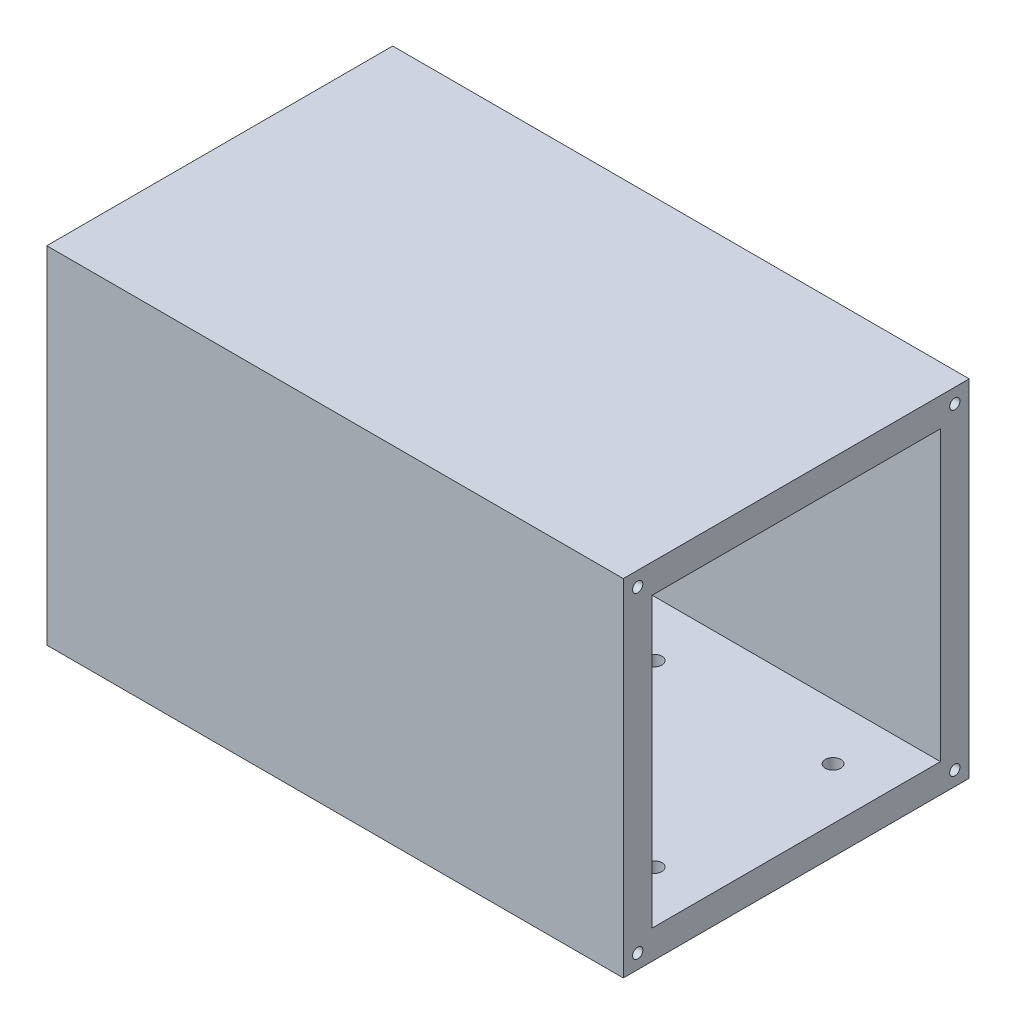
from build123d import *

# Parameters (mm, degrees)
BOSS_EXTRUDE1_DEPTH            = 63.5
BOSS_EXTRUDE1_DEPTH_BACK       = 63.5
SKETCH1_W                      = 76.2
SKETCH1_H                      = 76.2
SKETCH1_W_2                    = 63.5
SKETCH1_H_2                    = 63.5
F_4_40_TAPPED_HOLE1_AT_2_COUNT = 2
F_4_40_TAPPED_HOLE1_AT_2_PITCH = 69.85
F_4_40_TAPPED_HOLE1_AT_3_COUNT = 2
F_4_40_TAPPED_HOLE1_AT_3_PITCH = 98.782817332
F_4_40_TAPPED_HOLE1_AT_4_COUNT = 2
F_4_40_TAPPED_HOLE1_AT_4_PITCH = 69.85
CBORE_FOR_M3_SHCS1_D           = 3.4
CBORE_FOR_M3_SHCS1_DEPTH       = 6.35
CBORE_FOR_M3_SHCS1_CBORE_D     = 6.5
CBORE_FOR_M3_SHCS1_CBORE_DEPTH = 3


with BuildPart() as part:
    # Sketch1 → Boss-Extrude1 (new, two sides: drawn at the far end of the back side and taken through both)
    with BuildSketch(Plane(origin=(0, 0, 0), x_dir=(0, 0, -1), z_dir=(1, 0, 0)).offset(-BOSS_EXTRUDE1_DEPTH_BACK)):
        Rectangle(SKETCH1_W, SKETCH1_H)
        Rectangle(SKETCH1_W_2, SKETCH1_H_2, mode=Mode.SUBTRACT)
    extrude(amount=BOSS_EXTRUDE1_DEPTH + BOSS_EXTRUDE1_DEPTH_BACK)

    # Sketch3 → #4-40 Tapped Hole1 (revolve, cut)
    with BuildSketch(Plane(origin=(63.5, 34.925, 34.925), x_dir=(0, 0, -1), z_dir=(0, 1, 0))):
        Polygon((0, 0), (0, 8.299152758), (1.1303, 7.62), (1.1303, 0), align=None)
    f_4_40_tapped_hole1 = revolve(axis=Axis((69.85, 34.925, 34.925), (-1, 0, 0)), mode=Mode.SUBTRACT)

    # #4-40 Tapped Hole1 at 2: #4-40 Tapped Hole1 ×2
    with Locations(*[(0, 0, -i * F_4_40_TAPPED_HOLE1_AT_2_PITCH) for i in range(1, F_4_40_TAPPED_HOLE1_AT_2_COUNT)]):
        add(f_4_40_tapped_hole1, mode=Mode.SUBTRACT)

    # #4-40 Tapped Hole1 at 3: #4-40 Tapped Hole1 ×2
    with Locations(*[Vector(0, -0.7071067811865475, -0.7071067811865476) * (i * F_4_40_TAPPED_HOLE1_AT_3_PITCH) for i in range(1, F_4_40_TAPPED_HOLE1_AT_3_COUNT)]):
        add(f_4_40_tapped_hole1, mode=Mode.SUBTRACT)

    # #4-40 Tapped Hole1 at 4: #4-40 Tapped Hole1 ×2
    with Locations(*[(0, -i * F_4_40_TAPPED_HOLE1_AT_4_PITCH, 0) for i in range(1, F_4_40_TAPPED_HOLE1_AT_4_COUNT)]):
        add(f_4_40_tapped_hole1, mode=Mode.SUBTRACT)

    # Mirror1: #4-40 Tapped Hole1 across plane
    add(f_4_40_tapped_hole1.mirror(Plane(origin=(0, 0, 0), x_dir=(0, 0, 1), z_dir=(1, 0, 0))), mode=Mode.SUBTRACT)

    # Mirror1 copy 1 sketch → Mirror1 copy 1 (revolve, cut)
    with BuildSketch(Plane(origin=(-63.5, 34.925, -34.925), x_dir=(0, 0, -1), z_dir=(0, 1, 0))):
        Polygon((0, 0), (0, -8.299152758), (1.1303, -7.62), (1.1303, 0), align=None)
    revolve(axis=Axis((-69.85, 34.925, -34.925), (-1, 0, 0)), mode=Mode.SUBTRACT)

    # Mirror1 copy 2 sketch → Mirror1 copy 2 (revolve, cut)
    with BuildSketch(Plane(origin=(-63.5, -34.925, -34.925), x_dir=(0, 0, -1), z_dir=(0, 1, 0))):
        Polygon((0, 0), (0, -8.299152758), (1.1303, -7.62), (1.1303, 0), align=None)
    revolve(axis=Axis((-69.85, -34.925, -34.925), (-1, 0, 0)), mode=Mode.SUBTRACT)

    # Mirror1 copy 3 sketch → Mirror1 copy 3 (revolve, cut)
    with BuildSketch(Plane(origin=(-63.5, -34.925, 34.925), x_dir=(0, 0, -1), z_dir=(0, 1, 0))):
        Polygon((0, 0), (0, -8.299152758), (1.1303, -7.62), (1.1303, 0), align=None)
    revolve(axis=Axis((-69.85, -34.925, 34.925), (-1, 0, 0)), mode=Mode.SUBTRACT)

    # CBORE for M3 SHCS1
    with Locations(Plane(origin=(0, -38.1, 0), x_dir=(-1, 0, 0), z_dir=(0, -1, 0))):
        with Locations((-52.09999994, 19.499999922), (-12.7, 19.499999922), (-12.7, -19.900000078), (-52.1, -19.900000078)):
            CounterBoreHole(CBORE_FOR_M3_SHCS1_D / 2, CBORE_FOR_M3_SHCS1_CBORE_D / 2, CBORE_FOR_M3_SHCS1_CBORE_DEPTH, depth=CBORE_FOR_M3_SHCS1_DEPTH)


solid = part.part
